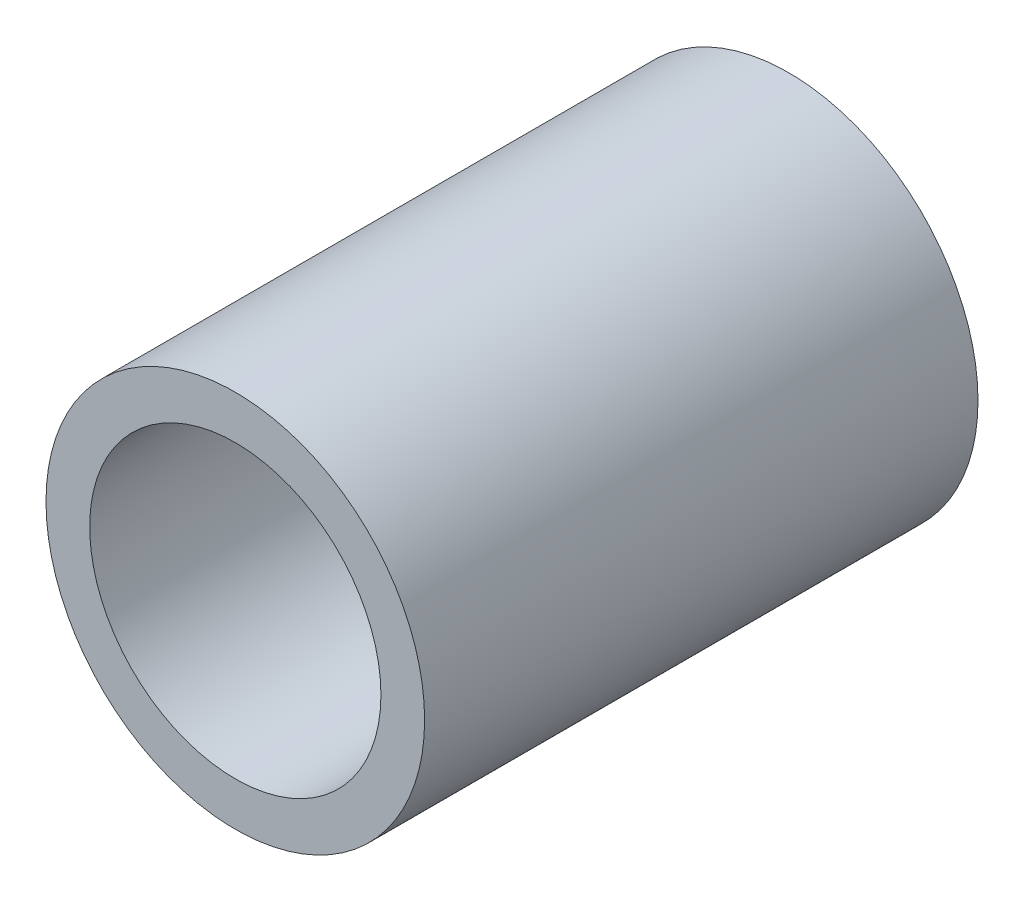
from build123d import *

# Parameters (mm, degrees)
SKETCH2_R           = 3.25
SKETCH2_R_2         = 2.5
BOSS_EXTRUDE1_DEPTH = 9.5


with BuildPart() as part:
    # Sketch2 → Boss-Extrude1 (new body)
    with BuildSketch(Plane.XY):
        Circle(SKETCH2_R)
        Circle(SKETCH2_R_2, mode=Mode.SUBTRACT)
    extrude(amount=BOSS_EXTRUDE1_DEPTH)


solid = part.part
